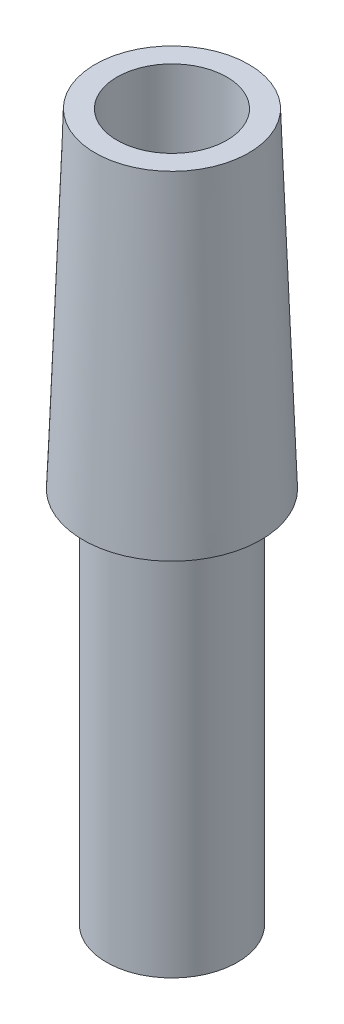
from build123d import *


with BuildPart() as part:
    # Schizzo1 → Rivoluzione1 (revolve)
    with BuildSketch(Plane.XY, mode=Mode.PRIVATE) as rivoluzione1_sk:
        Polygon((1.485, 0), (1.485, 18.8), (2.5, 18.8), (2.5, 32.2), (3.5, 32.2), (4.05, 17.2), (2.985, 17.2), (2.985, 0), align=None)
    revolve(rivoluzione1_sk.sketch.rotate(Axis((0, 0, 0), (0, 1, 0)), 90), axis=Axis((0, 0, 0), (0, 1, 0)))


solid = part.part
